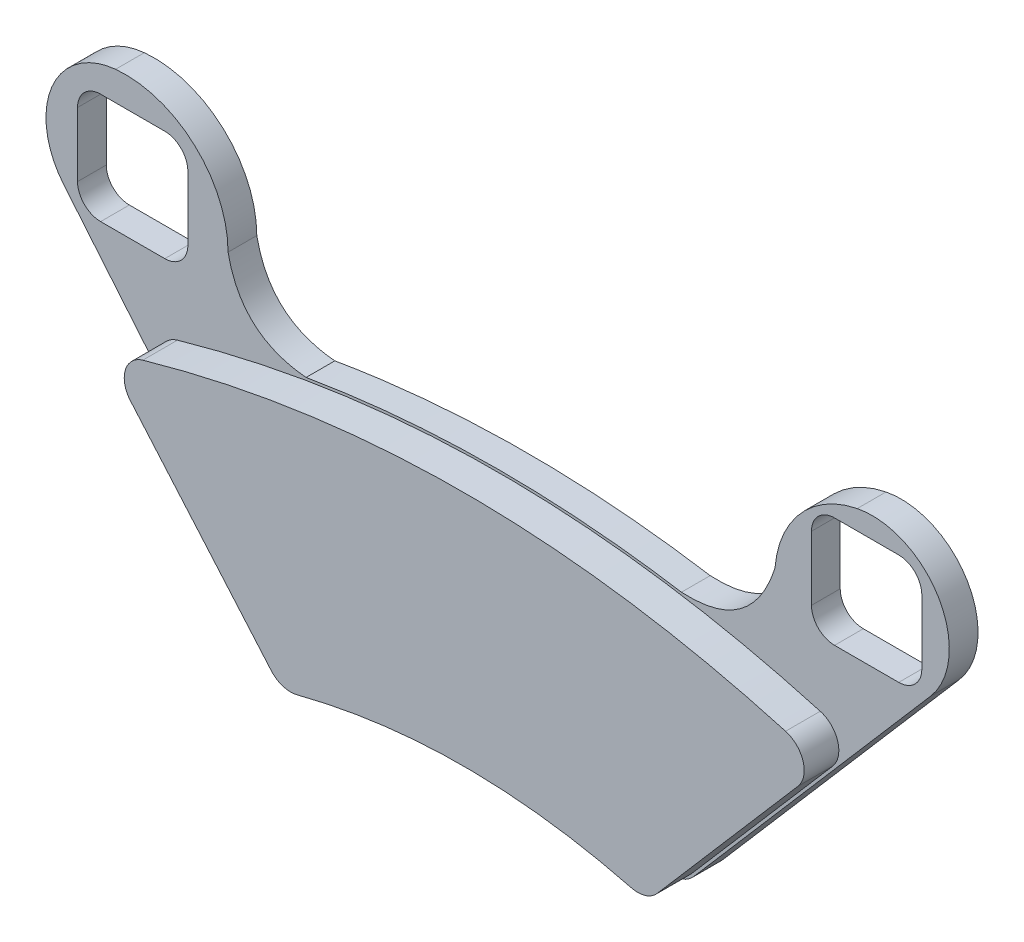
from build123d import *

# Parameters (mm, degrees)
BOSS_EXTRUDE1_DEPTH = 3.429
FILLET1_R           = 2.54
BOSS_EXTRUDE2_DEPTH = 2.8448
BOSS_EXTRUDE3_DEPTH = 2.8448
FILLET2_R           = 7.62
CUT_EXTRUDE1_DEPTH  = 2.8448
BOSS_EXTRUDE4_DEPTH = 2.8448
CUT_EXTRUDE2_DEPTH  = 2.8448
FILLET3_R           = 7.62
BOSS_EXTRUDE5_DEPTH = 0.0254


with BuildPart() as part:
    # Sketch1 → Boss-Extrude1 (new body)
    with BuildSketch(Plane.XY):
        with BuildLine():
            Line((-35.365163415, 20.32), (-17.839163415, 0))
            add(Edge.make_bspline(
                [(-17.839163415, 0), (0.211689908, 5.080726576), (18.279636585, 0)],
                knots=[0, 0, 0, 1, 1, 1], degree=2))
            Line((18.279636585, 0), (35.805636585, 20.32))
            add(Edge.make_bspline(
                [(-35.365163415, 20.32), (0.209256434, 31.699614416), (35.805636585, 20.32)],
                knots=[0, 0, 0, 1, 1, 1], degree=2))
        make_face()
    extrude(amount=BOSS_EXTRUDE1_DEPTH)

    # Fillet1
    fillet1_edges = [part.edges().sort_by_distance(p)[0] for p in [
        (18.279636585, 0, 1.7145),
        (35.805636585, 20.32, 1.7145),
        (-17.839163415, 0, 1.7145),
        (-35.365163415, 20.32, 1.7145),
    ]]
    fillet(fillet1_edges, radius=FILLET1_R)

    # Sketch3 → Boss-Extrude2 (add)
    with BuildSketch(Plane(origin=(0, 0, 0), x_dir=(-1, 0, 0), z_dir=(0, 0, -1))):
        with BuildLine():
            Line((-33.44681638, 17.196237572), (-19.51455408, 1.042889978))
            ThreePointArc((-19.51455408, 1.042889978), (-18.233735028, 0.201395136), (-16.701721503, 0.162081334))
            add(Edge.make_bspline(
                [(-16.701721503, 0.162081334), (-11.287416328, 1.557018557), (-5.815998288, 2.280480011), (1.099570731, 2.287789464), (2.486501294, 2.244377729), (5.268126494, 2.066272068), (6.66342146, 1.931190975), (10.814897092, 1.394504939), (13.552184291, 0.860935066), (16.260993662, 0.162500978)],
                knots=[0, 0, 0, 0, 0.5, 0.5, 0.625, 0.625, 0.75, 0.75, 1, 1, 1, 1], degree=3))
            ThreePointArc((16.260993662, 0.162500978), (17.793263077, 0.201606931), (19.074330708, 1.043179601))
            Line((19.074330708, 1.043179601), (33.006779663, 17.196743606))
            ThreePointArc((33.006779663, 17.196743606), (33.568121111, 19.821332934), (31.659110958, 21.707931354))
            add(Edge.make_bspline(
                [(31.659110958, 21.707931354), (21.234977833, 24.688407586), (10.651761037, 26.253278411), (-1.450873571, 26.265063816), (-2.798343422, 26.242056629), (-5.498815234, 26.146814801), (-6.854115547, 26.074394022), (-10.909317669, 25.783877715), (-13.59595314, 25.493149433), (-21.607199162, 24.340406402), (-26.883182271, 23.198023422), (-32.098788298, 21.707528048)],
                knots=[0, 0, 0, 0, 0.5, 0.5, 0.5625, 0.5625, 0.625, 0.625, 0.75, 0.75, 1, 1, 1, 1], degree=3))
            ThreePointArc((-32.098788298, 21.707528048), (-34.008104328, 19.821005964), (-33.44681638, 17.196237572))
        make_face()
    extrude(amount=BOSS_EXTRUDE2_DEPTH)

    # Sketch6 → Boss-Extrude3 (add)
    with BuildSketch(Plane(origin=(0, 0, -2.8448), x_dir=(-1, 0, 0), z_dir=(0, 0, -1))):
        with BuildLine():
            Line((18.860011299, 24.632736939), (22.773121111, 23.894535093))
            Line((22.773121111, 23.894535093), (30.902144608, 14.756587021))
            Line((30.902144608, 14.756587021), (46.651415509, 33.752843138))
            ThreePointArc((46.651415509, 33.752843138), (35.612340647, 41.602210449), (26.583121111, 31.505332934))
            add(Edge.make_bspline(
                [(26.583121111, 31.505332934), (25.303985062, 25.198624265), (18.860011299, 24.632736939)],
                knots=[0, 0, 0, 1, 1, 1], degree=2))
        make_face()
    extrude(amount=-BOSS_EXTRUDE3_DEPTH)

    # Fillet2
    fillet2_edges = [part.edges().sort_by_distance(p)[0] for p in [
        (-46.651415509, 33.752843138, -1.4224),
    ]]
    fillet(fillet2_edges, radius=FILLET2_R)

    # Sketch8 → Cut-Extrude1 (cut)
    with BuildSketch(Plane(origin=(0, 0, -2.8448), x_dir=(-1, 0, 0), z_dir=(0, 0, -1))):
        with BuildLine():
            Line((32.846126677, 38.744332934), (39.196126677, 38.744332934))
            ThreePointArc((39.196126677, 38.744332934), (40.812572779, 38.074779036), (41.482126677, 36.458332934))
            Line((41.482126677, 36.458332934), (41.482126677, 30.108332934))
            ThreePointArc((41.482126677, 30.108332934), (40.812572779, 28.491886832), (39.196126677, 27.822332934))
            Line((39.196126677, 27.822332934), (32.846126677, 27.822332934))
            ThreePointArc((32.846126677, 27.822332934), (31.229680575, 28.491886832), (30.560126677, 30.108332934))
            Line((30.560126677, 30.108332934), (30.560126677, 36.458332934))
            ThreePointArc((30.560126677, 36.458332934), (31.229680575, 38.074779036), (32.846126677, 38.744332934))
        make_face()
    extrude(amount=-CUT_EXTRUDE1_DEPTH, mode=Mode.SUBTRACT)

    # Sketch9 → Boss-Extrude4 (add)
    with BuildSketch(Plane(origin=(0, 0, -2.8448), x_dir=(-1, 0, 0), z_dir=(0, 0, -1))):
        with BuildLine():
            Line((-47.463840908, 33.447860213), (-33.44681638, 17.196237572))
            Line((-33.44681638, 17.196237572), (-23.253298607, 23.884814358))
            Line((-23.253298607, 23.884814358), (-18.292818846, 24.798887742))
            add(Edge.make_bspline(
                [(-27.552629507, 31.505332934), (-25.268328972, 24.405957798), (-18.292818846, 24.798887742)],
                knots=[0, 0, 0, 1, 1, 1], degree=2))
            ThreePointArc((-27.552629507, 31.505332934), (-36.694543436, 40.817065736), (-47.463840908, 33.447860213))
        make_face()
    extrude(amount=-BOSS_EXTRUDE4_DEPTH)

    # Sketch10 → Cut-Extrude2 (cut)
    with BuildSketch(Plane(origin=(0, 0, -2.8448), x_dir=(-1, 0, 0), z_dir=(0, 0, -1))):
        with BuildLine():
            Line((-39.797873323, 38.744332934), (-33.447873323, 38.744332934))
            ThreePointArc((-33.447873323, 38.744332934), (-31.831427221, 38.074779036), (-31.161873323, 36.458332934))
            Line((-31.161873323, 36.458332934), (-31.161873323, 30.108332934))
            ThreePointArc((-31.161873323, 30.108332934), (-31.831427221, 28.491886832), (-33.447873323, 27.822332934))
            Line((-33.447873323, 27.822332934), (-39.797873323, 27.822332934))
            ThreePointArc((-39.797873323, 27.822332934), (-41.414319425, 28.491886832), (-42.083873323, 30.108332934))
            Line((-42.083873323, 30.108332934), (-42.083873323, 36.458332934))
            ThreePointArc((-42.083873323, 36.458332934), (-41.414319425, 38.074779036), (-39.797873323, 38.744332934))
        make_face()
    extrude(amount=-CUT_EXTRUDE2_DEPTH, mode=Mode.SUBTRACT)

    # Fillet3
    fillet3_edges = [part.edges().sort_by_distance(p)[0] for p in [
        (47.463840908, 33.447860213, -1.4224),
    ]]
    fillet(fillet3_edges, radius=FILLET3_R)

    # Sketch11 → Boss-Extrude5 (add)
    with BuildSketch(Plane(origin=(0, 0, -2.8448), x_dir=(-1, 0, 0), z_dir=(0, 0, -1))):
        with BuildLine():
            Line((-32.96596357, 17.610973121), (-19.03370127, 1.457625527))
            ThreePointArc((-19.03370127, 1.457625527), (-18.043977457, 0.807379512), (-16.860148825, 0.777000665))
            add(Edge.make_bspline(
                [(-16.860148825, 0.777000665), (-11.393767532, 2.185354737), (-5.869704309, 2.915437473), (1.112358732, 2.922799867), (2.512622955, 2.878981915), (5.320986764, 2.699211385), (6.729692814, 2.562868028), (10.921080204, 2.021141726), (13.684690054, 1.482537974), (16.419535692, 0.777390745)],
                knots=[0, 0, 0, 0, 0.5, 0.5, 0.625, 0.625, 0.75, 0.75, 1, 1, 1, 1], degree=3))
            ThreePointArc((16.419535692, 0.777390745), (17.603562029, 0.807609004), (18.593477899, 1.457915149))
            Line((18.593477899, 1.457915149), (32.525926853, 17.611479154))
            ThreePointArc((32.525926853, 17.611479154), (32.9596907, 19.639570906), (31.484546495, 21.097396958))
            add(Edge.make_bspline(
                [(31.484546495, 21.097396958), (21.117495606, 24.061552194), (10.592269896, 25.618335787), (-1.444129852, 25.63005698), (-2.78422621, 25.607170327), (-5.469922522, 25.512428381), (-6.817808951, 25.44038787), (-10.850823746, 25.151400244), (-13.522755051, 24.862204706), (-21.490147902, 23.715583367), (-26.737240722, 22.579309276), (-31.924305501, 21.096970308)],
                knots=[0, 0, 0, 0, 0.5, 0.5, 0.5625, 0.5625, 0.625, 0.625, 0.75, 0.75, 1, 1, 1, 1], degree=3))
            ThreePointArc((-31.924305501, 21.096970308), (-33.399686074, 19.639203245), (-32.96596357, 17.610973121))
        make_face()
    extrude(amount=BOSS_EXTRUDE5_DEPTH)


solid = part.part
